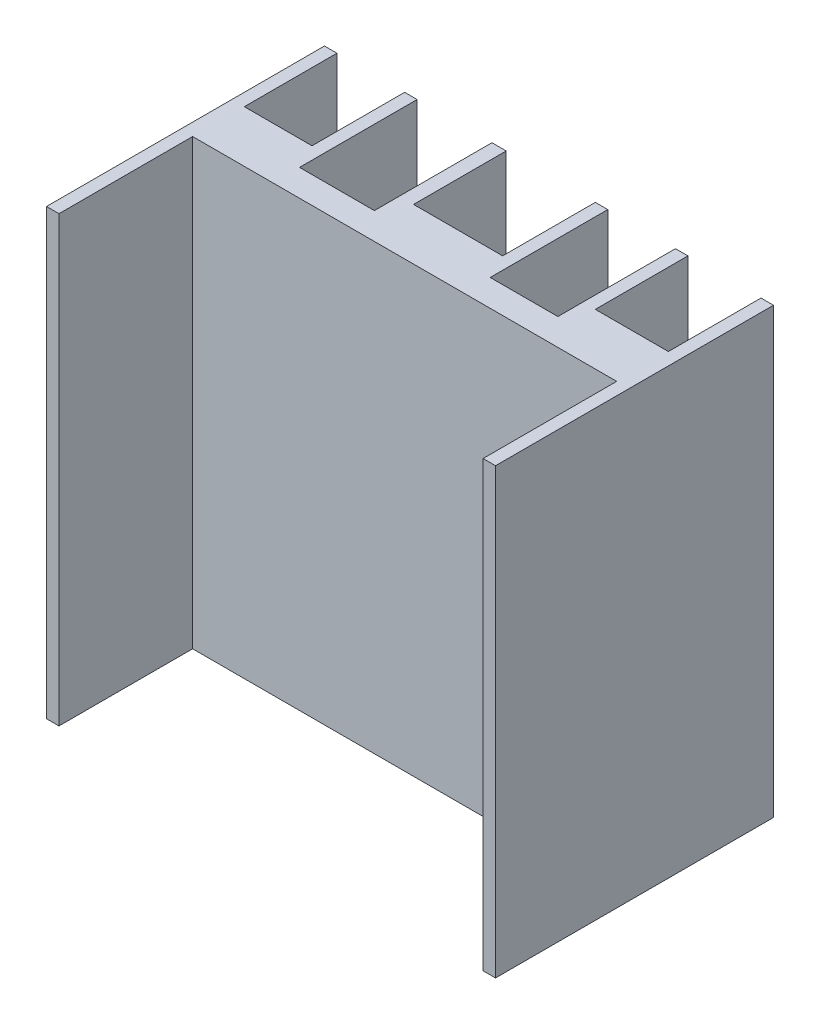
from build123d import *

# Parameters (mm, degrees)
EXTRUDE_1_DEPTH = 24.9


with BuildPart() as part:
    # 草图1 → 凸台-拉伸1 (new body)
    with BuildSketch(Plane(origin=(0, 0, 0), x_dir=(1, 0, 0), z_dir=(0, 1, 0))):
        Polygon((-2.4, 16.3), (2.6, 16.3), (2.6, 21.5), (3.3, 21.5), (3.3, 14.9), (7.1, 14.9), (7.1, 21.5), (7.8, 21.5), (7.8, 16.3), (11.9, 16.3), (11.9, 21.5), (12.6, 21.5), (12.6, 5.9), (11.9, 5.9), (11.9, 13.4), (-11.9, 13.4), (-11.9, 5.9), (-12.6, 5.9), (-12.6, 21.5), (-11.9, 21.5), (-11.9, 16.3), (-8.1, 16.3), (-8.1, 21.5), (-7.4, 21.5), (-7.4, 14.9), (-3.2, 14.9), (-3.2, 21.5), (-2.4, 21.5), align=None)
    extrude(amount=EXTRUDE_1_DEPTH)


solid = part.part
